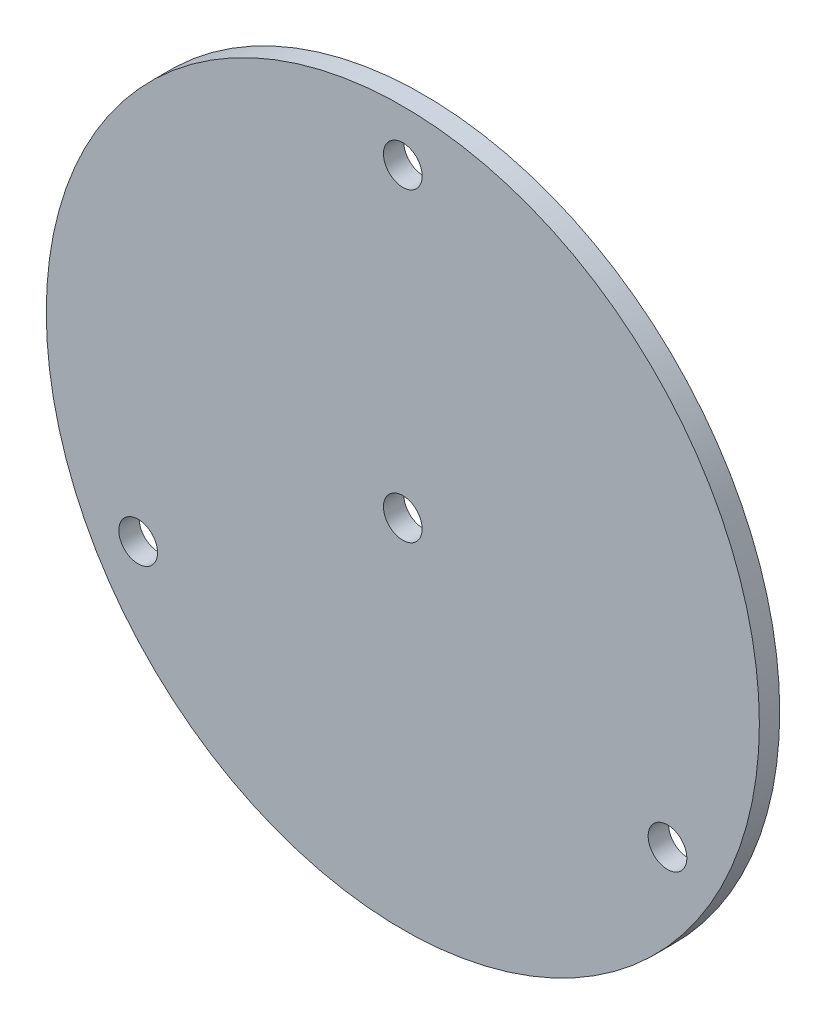
from build123d import *

# Parameters (mm, degrees)
SKETCH_1_R               = 35
EXTRUDE_1_DEPTH          = 2
CUT_EXTRUDE_1_DEPTH      = 50.537864306
CUT_EXTRUDE_1_DEPTH_BACK = 50.537864306
SKETCH_2_R               = 1.9


with BuildPart() as part:
    # ｽｹｯﾁ1 → ﾎﾞｽ - 押し出し1 (new body)
    with BuildSketch(Plane.XY):
        Circle(SKETCH_1_R)
    extrude(amount=EXTRUDE_1_DEPTH)

    # ｽｹｯﾁ2 → ｶｯﾄ - 押し出し1 (cut, two sides: drawn at the far end of the back side and taken through both)
    with BuildSketch(Plane.XY.offset(-CUT_EXTRUDE_1_DEPTH_BACK)):
        with Locations((0, 30)):
            Circle(SKETCH_2_R)
        with Locations((25.980762114, -15)):
            Circle(SKETCH_2_R)
        with Locations((-25.980762114, -15)):
            Circle(SKETCH_2_R)
        Circle(SKETCH_2_R)
    extrude(amount=CUT_EXTRUDE_1_DEPTH + CUT_EXTRUDE_1_DEPTH_BACK, mode=Mode.SUBTRACT)


solid = part.part
